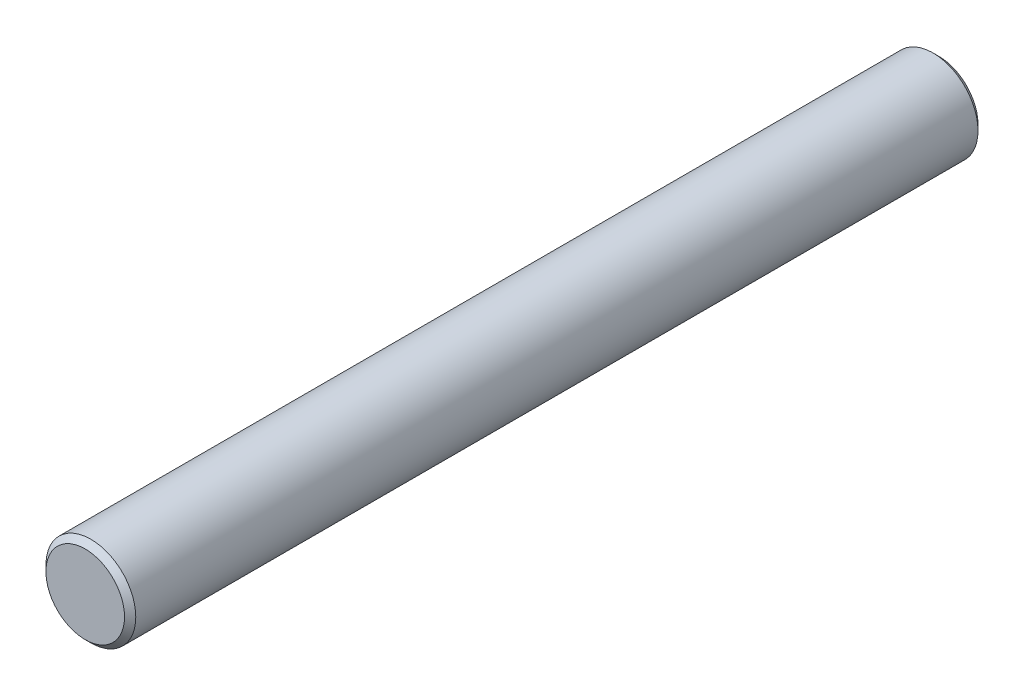
from build123d import *

# Parameters (mm, degrees)
SKETCH1_R           = 4
BOSS_EXTRUDE1_DEPTH = 76
CHAMFER1_SIZE       = 0.5


with BuildPart() as part:
    # Sketch1 → Boss-Extrude1 (new body)
    with BuildSketch(Plane.XY):
        Circle(SKETCH1_R)
    extrude(amount=BOSS_EXTRUDE1_DEPTH)

    # Chamfer1
    chamfer1_edges = [part.edges().sort_by_distance(p)[0] for p in [
        (-4, 0, 0),
        (-4, 0, 76),
    ]]
    chamfer(chamfer1_edges, length=CHAMFER1_SIZE)


solid = part.part
